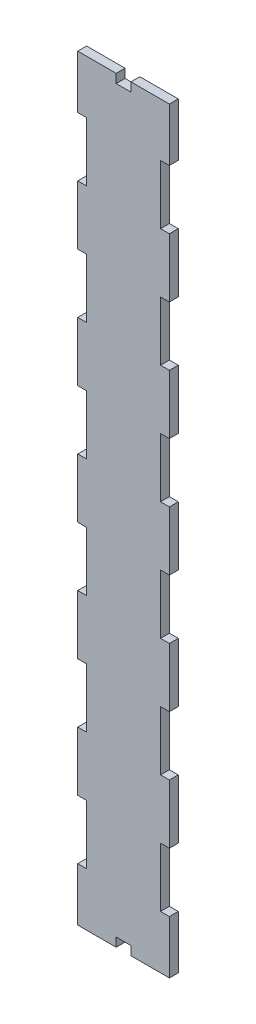
from build123d import *

# Parameters (mm, degrees)
BOSS_EXTRUDE3_DEPTH = 3


with BuildPart() as part:
    # Sketch2 → Boss-Extrude3 (new body)
    with BuildSketch(Plane.XY):
        Polygon((10, 250), (15, 250), (15, 253), (25, 253), (28, 253), (28, 235), (25, 235), (25, 215), (28, 215), (28, 195), (25, 195), (25, 175), (28, 175), (28, 155), (25, 155), (25, 135), (28, 135), (28, 115), (25, 115), (25, 95), (28, 95), (28, 75), (25, 75), (25, 55), (28, 55), (28, 35), (25, 35), (25, 15), (28, 15), (28, -3), (25, -3), (15, -3), (15, 0), (10, 0), (10, -3), (0, -3), (-3, -3), (-3, 15), (0, 15), (0, 35), (-3, 35), (-3, 55), (0, 55), (0, 75), (-3, 75), (-3, 95), (0, 95), (0, 115), (-3, 115), (-3, 135), (0, 135), (0, 155), (-3, 155), (-3, 175), (0, 175), (0, 195), (-3, 195), (-3, 215), (0, 215), (0, 235), (-3, 235), (-3, 253), (0, 253), (10, 253), align=None)
    extrude(amount=BOSS_EXTRUDE3_DEPTH)


solid = part.part
